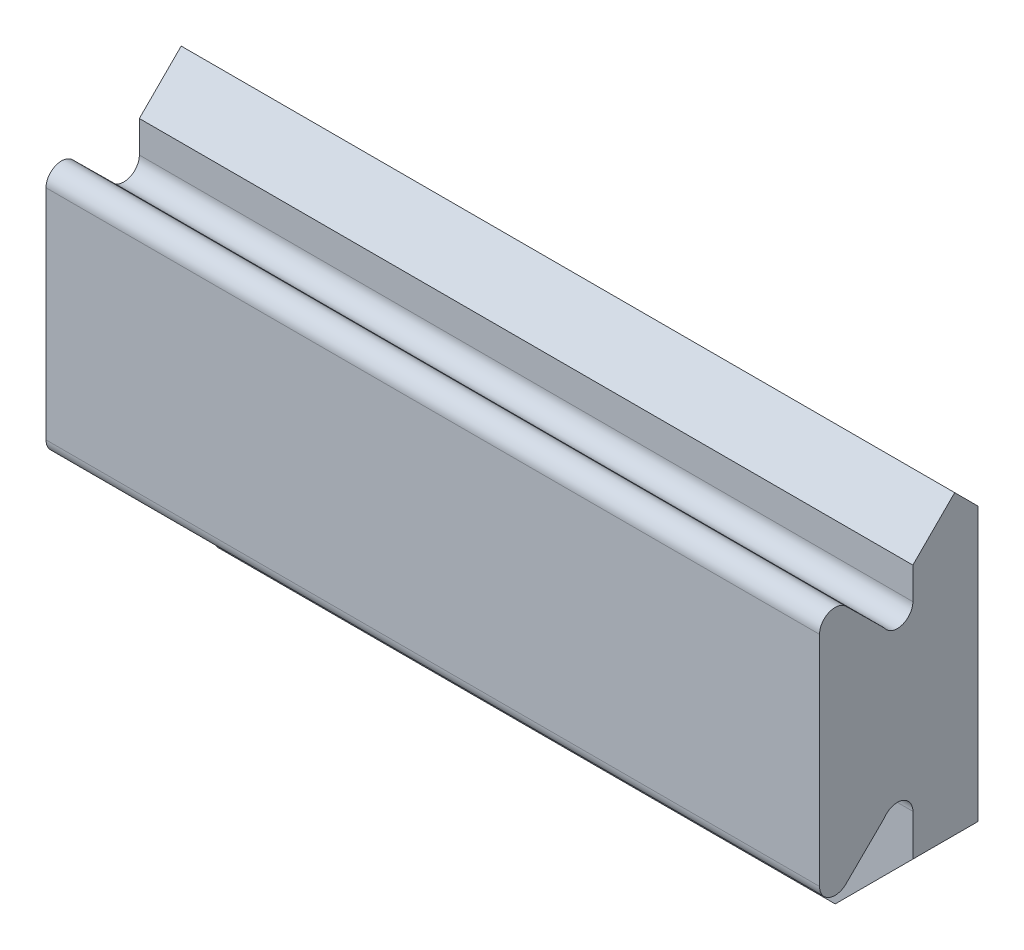
from build123d import *

# Parameters (mm, degrees)
EXTRUDE_1_DEPTH     = 49.8
CHAMFER_1_SIZE      = 5
SKETCH_3_W          = 0.807071686
SKETCH_3_H          = 22.587877847
CUT_EXTRUDE_1_DEPTH = 49.8


with BuildPart() as part:
    # 草图1 → 凸台-拉伸1 (new body)
    with BuildSketch(Plane(origin=(0, 0, 0), x_dir=(0, 0, -1), z_dir=(1, 0, 0))):
        with BuildLine():
            Line((-3.30116432, 4.869061466), (-14.31163185, 4.869061466))
            Line((-14.31163185, 4.869061466), (-14.31163185, -2.159184752))
            ThreePointArc((-14.31163185, -2.159184752), (-13.694314645, -3.083064362), (-12.604524306, -2.866290096))
            Line((-12.604524306, -2.866290096), (-10.135977537, -0.42662706))
            ThreePointArc((-10.135977537, -0.42662706), (-10.00408666, -0.265887616), (-9.841806105, -0.13589764))
            ThreePointArc((-9.841806105, -0.13589764), (-8.821917683, -0.099462208), (-8.30116432, -0.977138612))
            Line((-8.30116432, -0.977138612), (-8.30116432, -3.015902523))
            Line((-8.30116432, -3.015902523), (-8.30116432, -8.640917782))
            Line((-8.30116432, -8.640917782), (-3.30116432, -8.640917782))
            Line((-3.30116432, -8.640917782), (-3.30116432, 4.869061466))
        make_face()
        with BuildLine():
            ThreePointArc((-8.30116432, 10.715261544), (-8.821917683, 9.83758514), (-9.841806105, 9.874020573))
            ThreePointArc((-9.841806105, 9.874020573), (-10.00408666, 10.004010548), (-10.135977537, 10.164749992))
            Line((-10.135977537, 10.164749992), (-12.604524306, 12.604413029))
            ThreePointArc((-12.604524306, 12.604413029), (-13.694314645, 12.821187294), (-14.31163185, 11.897307685))
            Line((-14.31163185, 11.897307685), (-14.31163185, 4.869061466))
            Line((-14.31163185, 4.869061466), (-3.30116432, 4.869061466))
            Line((-3.30116432, 4.869061466), (-3.30116432, 13.139889713))
            Line((-3.30116432, 13.139889713), (-5.608236006, 15.446957584))
            Line((-5.608236006, 15.446957584), (-8.30116432, 12.754025455))
            Line((-8.30116432, 12.754025455), (-8.30116432, 10.715261544))
        make_face()
    extrude(amount=EXTRUDE_1_DEPTH)

    # 倒角1
    chamfer_1_edges = [part.edges().sort_by_distance(p)[0] for p in [
        (0, -8.640917782, 5.80116432),
        (49.8, -8.640917782, 5.80116432),
    ]]
    chamfer(chamfer_1_edges, length=CHAMFER_1_SIZE)

    # 草图3 → 切除-拉伸1 (cut)
    with BuildSketch(Plane(origin=(49.8, 0, 0), x_dir=(0, 0, -1), z_dir=(1, 0, 0))):
        with Locations((-3.704700163, 2.653021142)):
            Rectangle(SKETCH_3_W, SKETCH_3_H)
    extrude(amount=-CUT_EXTRUDE_1_DEPTH, mode=Mode.SUBTRACT)


solid = part.part
